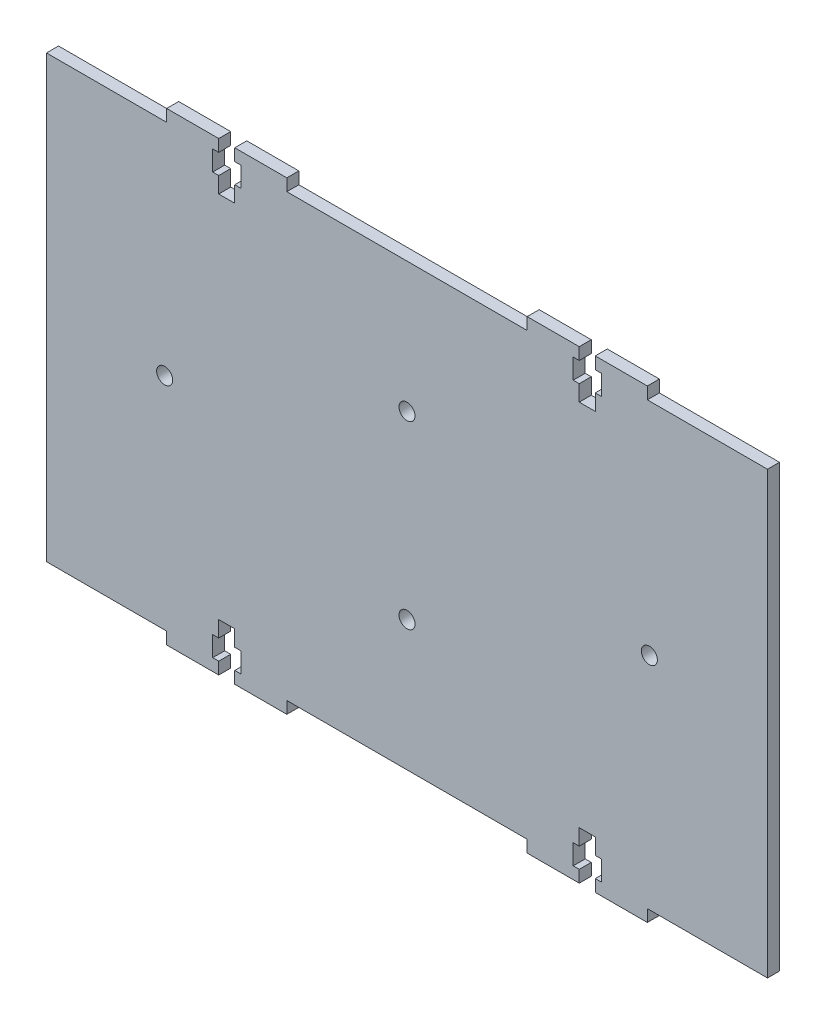
from build123d import *

# Parameters (mm, degrees)
EXTRUDE_1_DEPTH     = 3
CUT_EXTRUDE_1_DEPTH = 213.55117031


with BuildPart() as part:
    # 草图1 → 凸台-拉伸1 (new body)
    with BuildSketch(Plane.XY):
        Polygon((90, -55), (90, 0), (60, 0), (48.5, 0), (48.5, -5), (47, -5), (47, -9), (43, -9), (43, -5), (41.5, -5), (41.5, 0), (30, 0), (0, 0), (0, -55), align=None)
        Polygon((120, 0), (90, 0), (90, -55), (180, -55), (180, 0), (150, 0), (138.5, 0), (138.5, -5), (137, -5), (137, -9), (133, -9), (133, -5), (131.5, -5), (131.5, 0), align=None)
        Polygon((180, -55), (90, -55), (90, -110), (120, -110), (131.5, -110), (131.5, -105), (133, -105), (133, -101), (137, -101), (137, -105), (138.5, -105), (138.5, -110), (150, -110), (180, -110), align=None)
        Polygon((90, -110), (90, -55), (0, -55), (0, -110), (30, -110), (41.5, -110), (41.5, -105), (43, -105), (43, -101), (47, -101), (47, -105), (48.5, -105), (48.5, -110), (60, -110), align=None)
        Polygon((120, 3), (120, 0), (131.5, 0), (133, 0), (133, 3), align=None)
        Polygon((138.5, 0), (150, 0), (150, 3), (137, 3), (137, 0), align=None)
        Polygon((30, 3), (30, 0), (41.5, 0), (43, 0), (43, 3), align=None)
        Polygon((48.5, 0), (60, 0), (60, 3), (47, 3), (47, 0), align=None)
        Polygon((60, -113), (60, -110), (48.5, -110), (47, -110), (47, -113), align=None)
        Polygon((41.5, -110), (30, -110), (30, -113), (43, -113), (43, -110), align=None)
        Polygon((150, -113), (150, -110), (138.5, -110), (137, -110), (137, -113), align=None)
        Polygon((131.5, -110), (120, -110), (120, -113), (133, -113), (133, -110), align=None)
    extrude(amount=EXTRUDE_1_DEPTH)

    # 草图2 → 切除-拉伸1 (cut, through all)
    with BuildSketch(Plane.XY.offset(3)):
        with BuildLine():
            ThreePointArc((31.5, -55), (30.914213562, -53.585786438), (29.5, -53))
            Line((29.5, -53), (29.5, -55))
            Line((29.5, -55), (31.5, -55))
        make_face()
        with BuildLine():
            Line((29.5, -55), (29.5, -53))
            ThreePointArc((29.5, -53), (28.085786438, -53.585786438), (27.5, -55))
            Line((27.5, -55), (29.5, -55))
        make_face()
        with BuildLine():
            ThreePointArc((29.5, -57), (30.914213562, -56.414213562), (31.5, -55))
            Line((31.5, -55), (29.5, -55))
            Line((29.5, -55), (29.5, -57))
        make_face()
        with BuildLine():
            Line((29.5, -57), (29.5, -55))
            Line((29.5, -55), (27.5, -55))
            ThreePointArc((27.5, -55), (28.085786438, -56.414213562), (29.5, -57))
        make_face()
        with BuildLine():
            ThreePointArc((92, -77.5), (91.414213562, -76.085786438), (90, -75.5))
            Line((90, -75.5), (90, -77.5))
            Line((90, -77.5), (92, -77.5))
        make_face()
        with BuildLine():
            Line((90, -77.5), (90, -75.5))
            ThreePointArc((90, -75.5), (88.585786438, -76.085786438), (88, -77.5))
            Line((88, -77.5), (90, -77.5))
        make_face()
        with BuildLine():
            Line((92, -77.5), (90, -77.5))
            Line((90, -77.5), (90, -79.5))
            ThreePointArc((90, -79.5), (91.414213562, -78.914213562), (92, -77.5))
        make_face()
        with BuildLine():
            Line((90, -79.5), (90, -77.5))
            Line((90, -77.5), (88, -77.5))
            ThreePointArc((88, -77.5), (88.585786438, -78.914213562), (90, -79.5))
        make_face()
        with BuildLine():
            ThreePointArc((92, -32.5), (91.414213562, -31.085786438), (90, -30.5))
            Line((90, -30.5), (90, -32.5))
            Line((90, -32.5), (92, -32.5))
        make_face()
        with BuildLine():
            Line((90, -32.5), (90, -30.5))
            ThreePointArc((90, -30.5), (88.585786438, -31.085786438), (88, -32.5))
            Line((88, -32.5), (90, -32.5))
        make_face()
        with BuildLine():
            Line((92, -32.5), (90, -32.5))
            Line((90, -32.5), (90, -34.5))
            ThreePointArc((90, -34.5), (91.414213562, -33.914213562), (92, -32.5))
        make_face()
        with BuildLine():
            Line((90, -34.5), (90, -32.5))
            Line((90, -32.5), (88, -32.5))
            ThreePointArc((88, -32.5), (88.585786438, -33.914213562), (90, -34.5))
        make_face()
        with BuildLine():
            ThreePointArc((152.5, -55), (151.914213562, -53.585786438), (150.5, -53))
            Line((150.5, -53), (150.5, -55))
            Line((150.5, -55), (152.5, -55))
        make_face()
        with BuildLine():
            Line((150.5, -55), (150.5, -53))
            ThreePointArc((150.5, -53), (149.085786438, -53.585786438), (148.5, -55))
            Line((148.5, -55), (150.5, -55))
        make_face()
        with BuildLine():
            Line((150.5, -55), (148.5, -55))
            ThreePointArc((148.5, -55), (149.085786438, -56.414213562), (150.5, -57))
            Line((150.5, -57), (150.5, -55))
        make_face()
        with BuildLine():
            Line((152.5, -55), (150.5, -55))
            Line((150.5, -55), (150.5, -57))
            ThreePointArc((150.5, -57), (151.914213562, -56.414213562), (152.5, -55))
        make_face()
    extrude(amount=-CUT_EXTRUDE_1_DEPTH, mode=Mode.SUBTRACT)


solid = part.part
